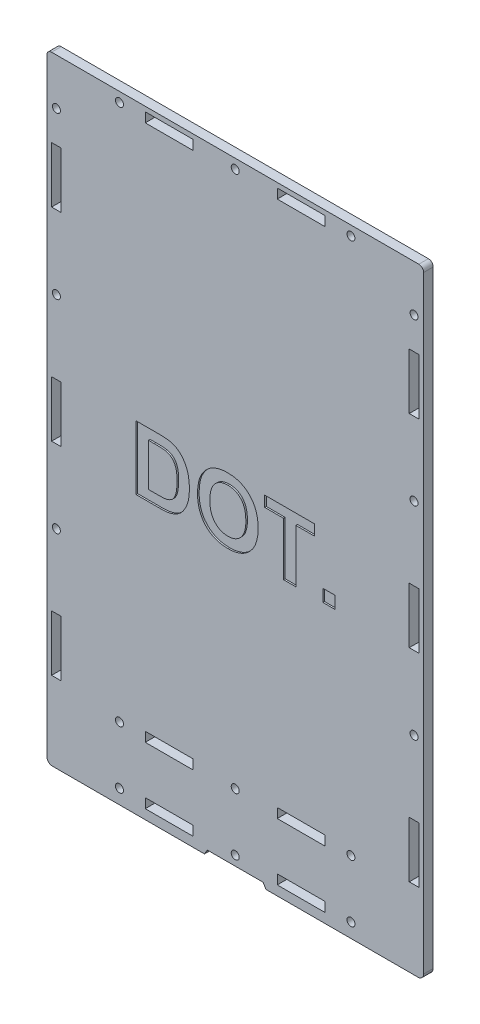
from build123d import *

# Parameters (mm, degrees)
SKETCH_1_R          = 2.5
SKETCH_1_W          = 30
SKETCH_1_H          = 6
SKETCH_1_W_2        = 6
SKETCH_1_H_2        = 35
EXTRUDE_1_DEPTH     = 6
FILLET_1_R          = 3.5
FILLET_2_R          = 3
SKETCH_2_W          = 7.692307692
SKETCH_2_H          = 7.692307692
CUT_EXTRUDE_1_DEPTH = 1


with BuildPart() as part:
    # Эскиз1 → Бобышка-Вытянуть1 (new body)
    with BuildSketch(Plane.XY):
        Polygon((-118, 9), (118, 9), (118, -378), (19.232050808, -378), (17.5, -375), (-17.5, -375), (-19.232050808, -378), (-118, -378), align=None)
        with Locations((0, 3)):
            Circle(SKETCH_1_R, mode=Mode.SUBTRACT)
        with Locations((-72.5, 3)):
            Circle(SKETCH_1_R, mode=Mode.SUBTRACT)
        with Locations((-112, -20)):
            Circle(SKETCH_1_R, mode=Mode.SUBTRACT)
        with Locations((-112, -121)):
            Circle(SKETCH_1_R, mode=Mode.SUBTRACT)
        with Locations((-112, -248)):
            Circle(SKETCH_1_R, mode=Mode.SUBTRACT)
        with Locations((-72.5, -369)):
            Circle(SKETCH_1_R, mode=Mode.SUBTRACT)
        with Locations((-72.5, -333)):
            Circle(SKETCH_1_R, mode=Mode.SUBTRACT)
        with Locations((0, -333)):
            Circle(SKETCH_1_R, mode=Mode.SUBTRACT)
        with Locations((0, -369)):
            Circle(SKETCH_1_R, mode=Mode.SUBTRACT)
        with Locations(Location((72.5, -333, 0), (0, 0, 180))):
            Circle(SKETCH_1_R, mode=Mode.SUBTRACT)
        with Locations(Location((72.5, -369, 0), (0, 0, 180))):
            Circle(SKETCH_1_R, mode=Mode.SUBTRACT)
        with Locations(Location((112, -248, 0), (0, 0, 180))):
            Circle(SKETCH_1_R, mode=Mode.SUBTRACT)
        with Locations(Location((112, -121, 0), (0, 0, 180))):
            Circle(SKETCH_1_R, mode=Mode.SUBTRACT)
        with Locations(Location((112, -20, 0), (0, 0, 180))):
            Circle(SKETCH_1_R, mode=Mode.SUBTRACT)
        with Locations(Location((72.5, 3, 0), (0, 0, 180))):
            Circle(SKETCH_1_R, mode=Mode.SUBTRACT)
        with Locations((-41.333333333, -369)):
            Rectangle(SKETCH_1_W, SKETCH_1_H, mode=Mode.SUBTRACT)
        with Locations((-41.333333333, -333)):
            Rectangle(SKETCH_1_W, SKETCH_1_H, mode=Mode.SUBTRACT)
        with Locations((-112, -311.5)):
            Rectangle(SKETCH_1_W_2, SKETCH_1_H_2, mode=Mode.SUBTRACT)
        with Locations((-112, -184.5)):
            Rectangle(SKETCH_1_W_2, SKETCH_1_H_2, mode=Mode.SUBTRACT)
        with Locations((-112, -57.5)):
            Rectangle(SKETCH_1_W_2, SKETCH_1_H_2, mode=Mode.SUBTRACT)
        with Locations((-41.333333333, 3)):
            Rectangle(SKETCH_1_W, SKETCH_1_H, mode=Mode.SUBTRACT)
        with Locations((41.333333333, 3)):
            Rectangle(SKETCH_1_W, SKETCH_1_H, mode=Mode.SUBTRACT)
        with Locations((112, -57.5)):
            Rectangle(SKETCH_1_W_2, SKETCH_1_H_2, mode=Mode.SUBTRACT)
        with Locations((112, -184.5)):
            Rectangle(SKETCH_1_W_2, SKETCH_1_H_2, mode=Mode.SUBTRACT)
        with Locations((112, -311.5)):
            Rectangle(SKETCH_1_W_2, SKETCH_1_H_2, mode=Mode.SUBTRACT)
        with Locations((41.333333333, -333)):
            Rectangle(SKETCH_1_W, SKETCH_1_H, mode=Mode.SUBTRACT)
        with Locations((41.333333333, -369)):
            Rectangle(SKETCH_1_W, SKETCH_1_H, mode=Mode.SUBTRACT)
    extrude(amount=EXTRUDE_1_DEPTH)

    # Скругление1
    fillet_1_edges = [part.edges().sort_by_distance(p)[0] for p in [
        (-118, -378, 3),
        (118, -378, 3),
    ]]
    fillet(fillet_1_edges, radius=FILLET_1_R)

    # Скругление2
    fillet_2_edges = [part.edges().sort_by_distance(p)[0] for p in [
        (-118, 9, 3),
        (118, 9, 3),
    ]]
    fillet(fillet_2_edges, radius=FILLET_2_R)

    # Эскиз2 → Вырез-Вытянуть1 (cut)
    # profile 1 of 4: a face of its own
    with BuildSketch(Plane.XY.offset(6)):
        with Locations((58.717948718, -200.653846154)):
            Rectangle(SKETCH_2_W, SKETCH_2_H)
    # profile 2 of 4: a face of its own
    with BuildSketch(Plane.XY.offset(6)):
        Polygon((30.256410256, -204.5), (30.256410256, -171.166666667), (18.461538462, -171.166666667), (18.461538462, -164.5), (49.743589744, -164.5), (49.743589744, -171.166666667), (37.948717949, -171.166666667), (37.948717949, -204.5), align=None)
    # profile 3 of 4: a face of its own
    with BuildSketch(Plane.XY.offset(6)):
        with BuildLine():
            add(Edge.make_bspline(
                [(-23.58974359, -184.740384615), (-23.586912953, -184.246081124), (-23.581353948, -183.275332872), (-23.485029294, -181.851208743), (-23.358065896, -180.48613259), (-23.151306207, -179.185473764), (-22.908081327, -177.943144735), (-22.603871555, -176.759514266), (-22.237406504, -175.638733317), (-21.945880656, -174.923126796), (-21.802884615, -174.572115385)],
                knots=[0, 0, 0, 0, 1.141009212, 2.240794809, 3.294380675, 4.305229195, 5.280013876, 6.216333343, 7.125095522, 8, 8, 8, 8], degree=3))
            add(Edge.make_bspline(
                [(-21.802884615, -174.572115385), (-21.569140357, -174.073112006), (-21.104401054, -173.080974343), (-20.241307127, -171.679004067), (-19.263041048, -170.356832503), (-18.177656616, -169.121391017), (-17.012864038, -167.99127849), (-15.763168364, -167.024064888), (-14.472967529, -166.187085354), (-13.555341826, -165.766134396), (-13.100961538, -165.557692308)],
                knots=[0, 0, 0, 0, 1.031372299, 2.050613973, 3.077158538, 4.108712802, 5.127684358, 6.111366908, 7.06480644, 8, 8, 8, 8], degree=3))
            add(Edge.make_bspline(
                [(-13.100961538, -165.557692308), (-12.792529901, -165.431180532), (-12.16911092, -165.175467976), (-11.200244442, -164.856325308), (-10.194616429, -164.597036316), (-9.159500525, -164.365262167), (-8.08484662, -164.205446264), (-6.979338365, -164.071446124), (-5.836925689, -164.001214319), (-5.06418327, -163.991908645), (-4.671474359, -163.987179487)],
                knots=[0, 0, 0, 0, 0.92659354, 1.872881803, 2.832850937, 3.813025581, 4.820167273, 5.851730198, 6.908245912, 8, 8, 8, 8], degree=3))
            add(Edge.make_bspline(
                [(-4.671474359, -163.987179487), (-3.968298642, -164.004805793), (-2.5921741, -164.039300717), (-0.58204258, -164.288453448), (1.320152163, -164.709170773), (3.107971166, -165.317263248), (4.796828453, -166.077392041), (6.373602605, -167.020245248), (7.840627285, -168.135618315), (9.195069006, -169.408215896), (10.414840789, -170.835820175), (11.477160677, -172.405095193), (12.368303442, -174.108687189), (13.102210962, -175.941895873), (13.666163588, -177.91070908), (14.073618837, -180.009571613), (14.31568024, -182.24002945), (14.344284138, -183.770222324), (14.358974359, -184.556089744)],
                knots=[0, 0, 0, 0, 1.064641025, 2.083517118, 3.061799897, 4.009540929, 4.938075217, 5.861300345, 6.78508344, 7.723570974, 8.670267188, 9.622657076, 10.586935816, 11.576069104, 12.607749008, 13.683335114, 14.81022093, 16, 16, 16, 16], degree=3))
            add(Edge.make_bspline(
                [(14.358974359, -184.556089744), (14.344623437, -185.336694884), (14.316684874, -186.856387254), (14.070105246, -189.069342593), (13.679542491, -191.152904357), (13.101944459, -193.102312932), (12.389940999, -194.932443607), (11.489628152, -196.621498065), (10.449556447, -198.191880502), (9.231517126, -199.604101226), (7.899871428, -200.884002249), (6.434707595, -201.98633941), (4.869411583, -202.930470134), (3.189762263, -203.692795577), (1.406707281, -204.288364604), (-0.485572244, -204.712314832), (-2.488046813, -204.960508791), (-3.858809543, -204.99512896), (-4.559294872, -205.012820513)],
                knots=[0, 0, 0, 0, 1.18845052, 2.313691126, 3.386664782, 4.412527756, 5.405809582, 6.372003093, 7.321919452, 8.268293321, 9.206237639, 10.129603466, 11.054616372, 11.9847576, 12.932764752, 13.912672021, 14.933336461, 16, 16, 16, 16], degree=3))
            add(Edge.make_bspline(
                [(-4.559294872, -205.012820513), (-5.26778158, -204.995088135), (-6.654493605, -204.960380778), (-8.678326431, -204.712942304), (-10.589390051, -204.288852521), (-12.386323614, -203.691188573), (-14.081382534, -202.940443777), (-15.65891699, -202.005960707), (-17.119799, -200.896642244), (-18.462571379, -199.631806779), (-19.679857541, -198.223738005), (-20.718452479, -196.66345269), (-21.618812283, -194.990896074), (-22.334559107, -193.18073293), (-22.908976517, -191.251587517), (-23.300493643, -189.192359375), (-23.54755007, -187.008716048), (-23.575422012, -185.510315306), (-23.58974359, -184.740384615)],
                knots=[0, 0, 0, 0, 1.080878253, 2.11558926, 3.1052859, 4.062802436, 5.000434901, 5.928596448, 6.853693179, 7.793554778, 8.738606028, 9.68692032, 10.647726704, 11.63151566, 12.651483354, 13.714466703, 14.825613081, 16, 16, 16, 16], degree=3))
        make_face()
        with BuildLine():
            add(Edge.make_bspline(
                [(-15.897435897, -184.475961538), (-15.889751378, -185.029267214), (-15.874870453, -186.10073313), (-15.716368896, -187.655939972), (-15.475830034, -189.109840261), (-15.122082304, -190.460783854), (-14.675189377, -191.709748058), (-14.127652899, -192.857777617), (-13.481735623, -193.906582408), (-12.720730862, -194.834020677), (-11.89738338, -195.662044285), (-11.008653227, -196.378493535), (-10.071103205, -196.995145772), (-9.068510857, -197.481990628), (-8.021741918, -197.868355285), (-6.922663728, -198.154830529), (-5.765811409, -198.312133571), (-4.976407496, -198.334692113), (-4.575320513, -198.346153846)],
                knots=[0, 0, 0, 0, 1.313550922, 2.543666373, 3.708465049, 4.810029406, 5.85539231, 6.85404609, 7.825601258, 8.772642133, 9.696587791, 10.59409323, 11.479048685, 12.35559886, 13.234601248, 14.125357077, 15.047515647, 16, 16, 16, 16], degree=3))
            add(Edge.make_bspline(
                [(-4.575320513, -198.346153846), (-4.174179496, -198.334924345), (-3.384669238, -198.312822873), (-2.229238339, -198.152303557), (-1.127982068, -197.87810725), (-0.085371633, -197.493722489), (0.903345039, -196.99914713), (1.837306768, -196.396318941), (2.711129968, -195.67661016), (3.533581247, -194.860615665), (4.274044661, -193.927017448), (4.914462476, -192.878393651), (5.461729187, -191.723401259), (5.908669176, -190.461608186), (6.253711098, -189.090640388), (6.484432984, -187.60977248), (6.644216255, -186.023238725), (6.659036489, -184.927778369), (6.666666667, -184.363782051)],
                knots=[0, 0, 0, 0, 0.949153107, 1.868086493, 2.754172764, 3.630100905, 4.492260106, 5.365378617, 6.254840125, 7.166615376, 8.102436631, 9.067266169, 10.06813181, 11.121736829, 12.23011542, 13.408501285, 14.665770308, 16, 16, 16, 16], degree=3))
            add(Edge.make_bspline(
                [(6.666666667, -184.363782051), (6.658048284, -183.805231419), (6.641357966, -182.723545044), (6.496002544, -181.157039783), (6.257937222, -179.699646907), (5.927000117, -178.35174396), (5.489645938, -177.113113744), (4.967277559, -175.980369105), (4.335659992, -174.959428007), (3.611272037, -174.050819075), (2.809703407, -173.251068035), (1.944572483, -172.55092026), (1.010963901, -171.96835475), (0.017989523, -171.478204908), (-1.044688542, -171.114564528), (-2.166271004, -170.849328302), (-3.349931861, -170.685995426), (-4.160798701, -170.66472154), (-4.575320513, -170.653846154)],
                knots=[0, 0, 0, 0, 1.332337092, 2.580197383, 3.749299508, 4.852775005, 5.886662144, 6.878700295, 7.822989687, 8.743523536, 9.644687758, 10.519443927, 11.392806431, 12.264866173, 13.155606721, 14.065961015, 15.011303331, 16, 16, 16, 16], degree=3))
            add(Edge.make_bspline(
                [(-4.575320513, -170.653846154), (-4.989894719, -170.664554254), (-5.800864049, -170.685500905), (-6.986369962, -170.851537988), (-8.111485768, -171.108870853), (-9.174013636, -171.493275141), (-10.175637134, -171.97871799), (-11.112651534, -172.58076388), (-11.992440214, -173.279723444), (-12.801190665, -174.091600547), (-13.537315986, -175.008166051), (-14.169237721, -176.04158201), (-14.708089833, -177.180562236), (-15.150186754, -178.428478213), (-15.477917281, -179.78876288), (-15.72980547, -181.252274299), (-15.871256535, -182.827870498), (-15.888521888, -183.914790561), (-15.897435897, -184.475961538)],
                knots=[0, 0, 0, 0, 0.981996942, 1.920933313, 2.83127778, 3.712125466, 4.592427284, 5.463259035, 6.34592384, 7.249932058, 8.173122297, 9.125107726, 10.113123258, 11.154048744, 12.256187849, 13.424658091, 14.670364834, 16, 16, 16, 16], degree=3))
        make_face(mode=Mode.SUBTRACT)
    # profile 4 of 4: a face of its own
    with BuildSketch(Plane.XY.offset(6)):
        with BuildLine():
            Line((-62.051282051, -164.5), (-47.379807692, -164.5))
            add(Edge.make_bspline(
                [(-47.379807692, -164.5), (-46.979105909, -164.499792272), (-46.198846457, -164.499387777), (-45.066485715, -164.546364301), (-44.007582841, -164.593616506), (-43.025177147, -164.688205084), (-42.115860371, -164.787350688), (-41.278000767, -164.912876483), (-40.516891147, -165.073751528), (-40.036935853, -165.200620744), (-39.807692308, -165.261217949)],
                knots=[0, 0, 0, 0, 1.259756885, 2.453039283, 3.563158368, 4.591894114, 5.55549294, 6.43918076, 7.254497783, 8, 8, 8, 8], degree=3))
            add(Edge.make_bspline(
                [(-39.807692308, -165.261217949), (-39.521009247, -165.354652431), (-38.952806964, -165.539838421), (-38.11980494, -165.864315108), (-37.330578895, -166.266731638), (-36.55584948, -166.689746276), (-35.830202831, -167.189911881), (-35.115236301, -167.710267243), (-34.457350074, -168.313044492), (-33.594616894, -169.155465388), (-32.610172756, -170.328984344), (-31.578817512, -171.885598266), (-30.70587794, -173.594196205), (-30.109445492, -175.125040468), (-29.706711145, -176.426387402), (-29.443448095, -177.469737667), (-29.21982215, -178.568774102), (-29.036224557, -179.723773774), (-28.893574512, -180.93473684), (-28.787370035, -182.201340531), (-28.735637743, -183.524679017), (-28.723924701, -184.425180404), (-28.717948718, -184.884615385)],
                knots=[0, 0, 0, 0, 0.745524535, 1.477620414, 2.207090574, 2.934465325, 3.657932502, 4.384347339, 5.118673636, 5.861150177, 7.365375624, 8.894729774, 10.468936425, 12.099947606, 12.950091786, 13.83580991, 14.759228729, 15.722225242, 16.726454549, 17.773376212, 18.863978586, 20, 20, 20, 20], degree=3))
            add(Edge.make_bspline(
                [(-28.717948718, -184.884615385), (-28.728857631, -185.678660048), (-28.749955251, -187.214326486), (-28.994372513, -189.430286744), (-29.346608665, -191.488511712), (-29.743651871, -192.772521933), (-29.935897436, -193.394230769)],
                knots=[0, 0, 0, 0, 1.103207939, 2.133582005, 3.096293362, 4, 4, 4, 4], degree=3))
            add(Edge.make_bspline(
                [(-29.935897436, -193.394230769), (-30.062843207, -193.750980853), (-30.312565344, -194.452763922), (-30.749560358, -195.465089445), (-31.221736558, -196.428466905), (-31.733010454, -197.342137281), (-32.285965154, -198.201990859), (-32.882668895, -199.005455765), (-33.513872314, -199.76310986), (-33.971142671, -200.229449543), (-34.198717949, -200.461538462)],
                knots=[0, 0, 0, 0, 1.090884612, 2.145940218, 3.175104604, 4.181306866, 5.161203701, 6.118658341, 7.063689906, 8, 8, 8, 8], degree=3))
            add(Edge.make_bspline(
                [(-34.198717949, -200.461538462), (-34.566989731, -200.79272817), (-35.326418642, -201.47568856), (-36.664662445, -202.320879335), (-38.177254249, -203.06771314), (-39.271370677, -203.451349269), (-39.83974359, -203.650641026)],
                knots=[0, 0, 0, 0, 0.908140292, 1.872714733, 2.8949153, 4, 4, 4, 4], degree=3))
            add(Edge.make_bspline(
                [(-39.83974359, -203.650641026), (-40.068542533, -203.720911995), (-40.543402901, -203.866755755), (-41.296340837, -204.022519908), (-42.100120973, -204.186618983), (-42.964012009, -204.285474798), (-43.879046336, -204.389722629), (-44.852515938, -204.448251959), (-45.881046305, -204.489804383), (-46.586490065, -204.49655107), (-46.947115385, -204.5)],
                knots=[0, 0, 0, 0, 0.799129865, 1.658552685, 2.566799617, 3.538529252, 4.561352959, 5.643373779, 6.795284424, 8, 8, 8, 8], degree=3))
            Line((-46.947115385, -204.5), (-62.051282051, -204.5))
            Line((-62.051282051, -204.5), (-62.051282051, -164.5))
        make_face()
        with BuildLine():
            Line((-54.358974359, -171.166666667), (-54.358974359, -197.833333333))
            Line((-54.358974359, -197.833333333), (-48.028846154, -197.833333333))
            add(Edge.make_bspline(
                [(-48.028846154, -197.833333333), (-47.743057461, -197.831066834), (-47.19280505, -197.826702956), (-46.396575722, -197.813880232), (-45.664847663, -197.779166681), (-44.993787642, -197.743209105), (-44.385142684, -197.683800893), (-43.836264477, -197.625370653), (-43.350208349, -197.543627969), (-43.050008139, -197.479101375), (-42.908653846, -197.448717949)],
                knots=[0, 0, 0, 0, 1.333384787, 2.567275092, 3.714769766, 4.750907381, 5.701951617, 6.567520054, 7.325492842, 8, 8, 8, 8], degree=3))
            add(Edge.make_bspline(
                [(-42.908653846, -197.448717949), (-42.577586067, -197.360372642), (-41.93275336, -197.188299286), (-41.027343049, -196.804698255), (-40.208063364, -196.341925575), (-39.461193881, -195.785461326), (-38.788109875, -195.082219216), (-38.213550397, -194.182827704), (-37.681810745, -193.11017644), (-37.317675305, -192.083380928), (-37.056299582, -191.166271191), (-36.879369663, -190.396518355), (-36.739546731, -189.563723622), (-36.619280774, -188.671173736), (-36.522103019, -187.720016468), (-36.461634422, -186.706817034), (-36.420364232, -185.632815686), (-36.413689511, -184.895341093), (-36.41025641, -184.516025641)],
                knots=[0, 0, 0, 0, 1.038686998, 2.023088296, 2.974059649, 3.888265163, 4.839857954, 5.909819677, 7.113156087, 8.466843969, 9.20827164, 10.006482943, 10.861893492, 11.769681931, 12.739021491, 13.762258324, 14.849031541, 16, 16, 16, 16], degree=3))
            add(Edge.make_bspline(
                [(-36.41025641, -184.516025641), (-36.41366311, -184.136709023), (-36.420262529, -183.40190127), (-36.46146942, -182.335908182), (-36.521598359, -181.33866382), (-36.619468179, -180.408935424), (-36.737869819, -179.545438058), (-36.87933054, -178.747440989), (-37.0551939, -178.020181235), (-37.316791939, -177.156183217), (-37.713361093, -176.185022606), (-38.253014316, -175.123208115), (-38.915727046, -174.21819372), (-39.647960085, -173.431992925), (-40.492237146, -172.784989397), (-41.426849813, -172.243086261), (-42.472147274, -171.822482334), (-43.215700197, -171.643333324), (-43.59775641, -171.551282051)],
                knots=[0, 0, 0, 0, 1.117996097, 2.165769068, 3.143980016, 4.062055362, 4.920439205, 5.712587309, 6.449616741, 7.124491204, 8.371470382, 9.537068822, 10.625202851, 11.666538334, 12.693249444, 13.747832046, 14.842779399, 16, 16, 16, 16], degree=3))
            add(Edge.make_bspline(
                [(-43.59775641, -171.551282051), (-43.763128952, -171.520553518), (-44.12721599, -171.452901049), (-44.731383392, -171.373882572), (-45.440206374, -171.315244111), (-46.257298379, -171.255379391), (-47.179350932, -171.221210494), (-48.210222116, -171.185549699), (-49.34559823, -171.173368036), (-50.138891733, -171.168964646), (-50.552884615, -171.166666667)],
                knots=[0, 0, 0, 0, 0.578738571, 1.274160813, 2.095454135, 3.025967819, 4.093109015, 5.270126069, 6.575371698, 8, 8, 8, 8], degree=3))
            Line((-50.552884615, -171.166666667), (-54.358974359, -171.166666667))
        make_face(mode=Mode.SUBTRACT)
    extrude(amount=-CUT_EXTRUDE_1_DEPTH, mode=Mode.SUBTRACT)


solid = part.part
